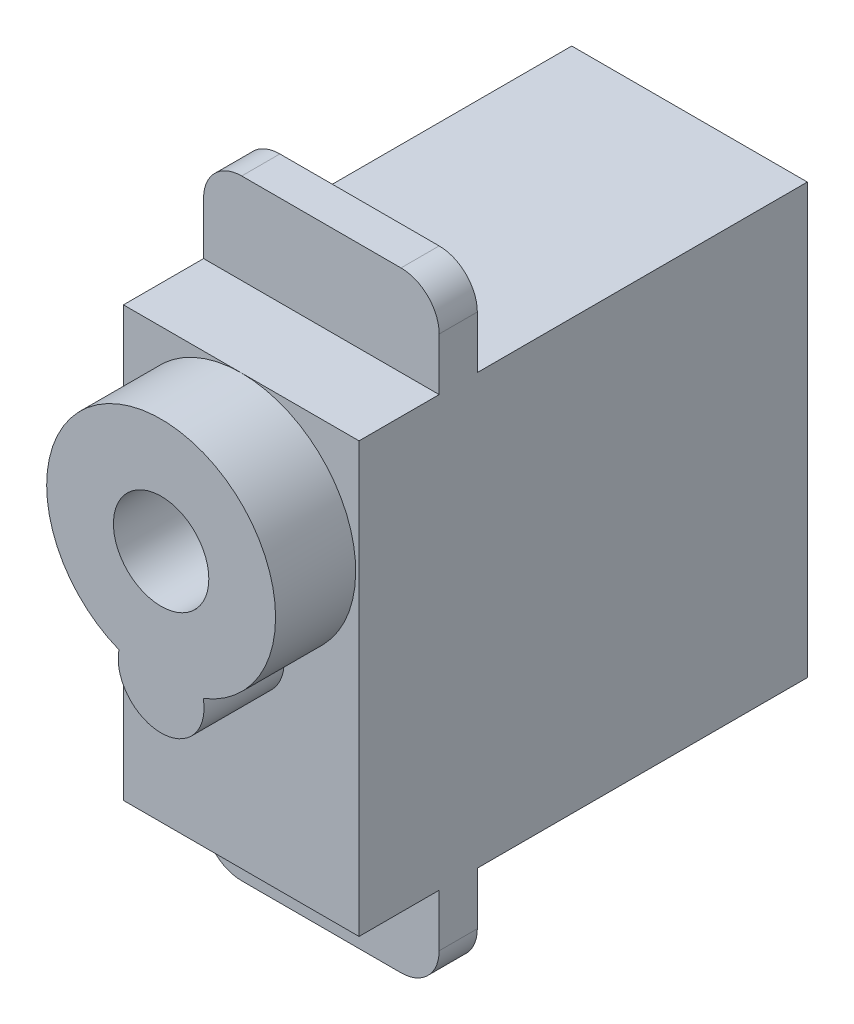
from build123d import *

# Parameters (mm, degrees)
SKETCH3_W           = 22.5
SKETCH3_H           = 23.5
BOSS_EXTRUDE1_DEPTH = 6.175
SKETCH4_W           = 12.35
SKETCH4_H           = 32
BOSS_EXTRUDE2_DEPTH = 2
BOSS_EXTRUDE3_DEPTH = 4.2
SKETCH6_R           = 2.5
CUT_EXTRUDE1_DEPTH  = 4.2
FILLET1_R           = 2


with BuildPart() as part:
    # Sketch3 → Boss-Extrude1 (new, symmetric)
    with BuildSketch(Plane(origin=(0, -28.275548605, 0), x_dir=(0, 1, 0), z_dir=(1, 0, 0))):
        with Locations((24.609729517, 167.116706922)):
            Rectangle(SKETCH3_W, SKETCH3_H)
    extrude(amount=BOSS_EXTRUDE1_DEPTH, both=True)

    # Sketch4 → Boss-Extrude2 (add)
    with BuildSketch(Plane.XY.offset(174.666706922)):
        with Locations((0, -3.665819089)):
            Rectangle(SKETCH4_W, SKETCH4_H)
    extrude(amount=-BOSS_EXTRUDE2_DEPTH)

    # Sketch5 → Boss-Extrude3 (add)
    with BuildSketch(Plane.XY.offset(178.866706922)):
        with BuildLine():
            ThreePointArc((2.210095356, -3.993944089), (0, 7.584180911), (-2.210095356, -3.993944089))
            ThreePointArc((-2.210095356, -3.993944089), (0, -6.665819089), (2.210095356, -3.993944089))
        make_face()
    extrude(amount=BOSS_EXTRUDE3_DEPTH)

    # Sketch6 → Cut-Extrude1 (cut)
    with BuildSketch(Plane.XY.offset(183.066706922)):
        with Locations((0, 1.584180911)):
            Circle(SKETCH6_R)
    extrude(amount=-CUT_EXTRUDE1_DEPTH, mode=Mode.SUBTRACT)

    # Fillet1
    fillet1_edges = [part.edges().sort_by_distance(p)[0] for p in [
        (-6.175, -19.665819089, 173.666706922),
        (6.175, 12.334180911, 173.666706922),
        (-6.175, 12.334180911, 173.666706922),
        (6.175, -19.665819089, 173.666706922),
    ]]
    fillet(fillet1_edges, radius=FILLET1_R)


solid = part.part
